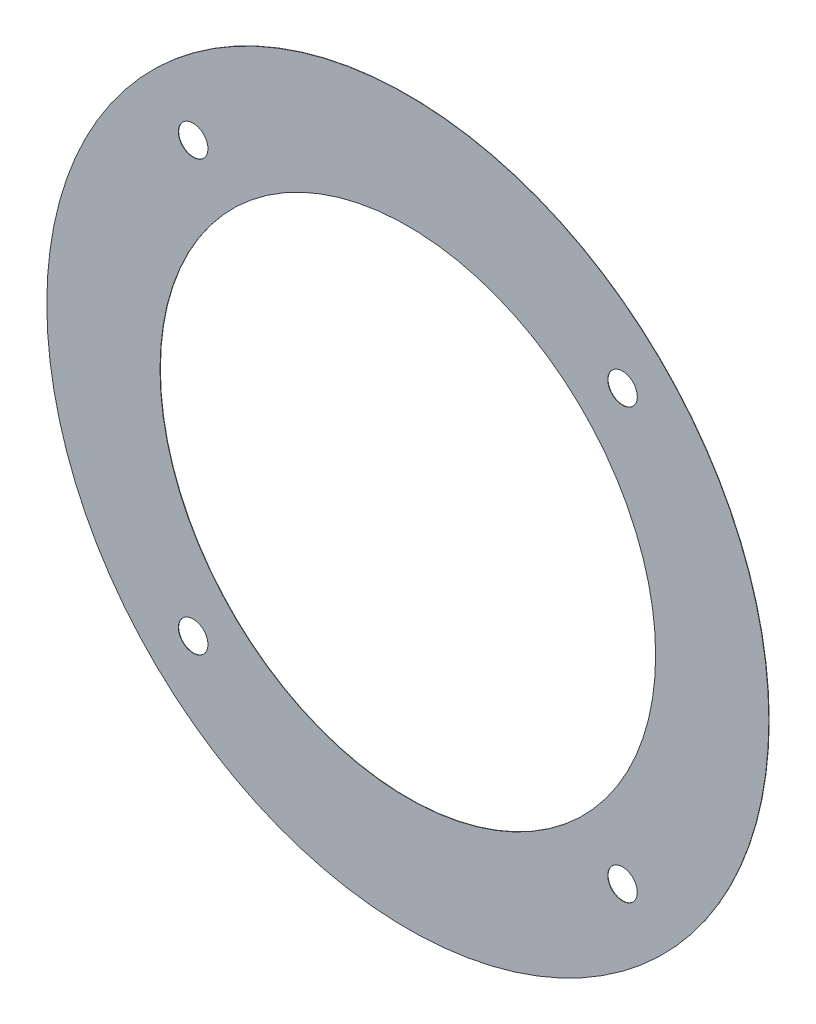
from build123d import *

# Parameters (mm, degrees)
SCHIZZO1_R                   = 110
SCHIZZO1_R_2                 = 75.5
ESTRUSIONE_ESTRUSIONE1_DEPTH = 0.1
SCHIZZO3_R                   = 4.5
TAGLIO_ESTRUSIONE1_DEPTH     = 156.563524002


with BuildPart() as part:
    # Schizzo1 → Estrusione-Estrusione1 (new body)
    with BuildSketch(Plane.XY):
        Circle(SCHIZZO1_R)
        Circle(SCHIZZO1_R_2, mode=Mode.SUBTRACT)
    extrude(amount=ESTRUSIONE_ESTRUSIONE1_DEPTH)

    # Schizzo3 → Taglio-Estrusione1 (cut, through all)
    with BuildSketch(Plane.XY.offset(0.1)):
        with Locations((-65.40737726, 65.40737726)):
            Circle(SCHIZZO3_R)
        with Locations((65.40737726, 65.40737726)):
            Circle(SCHIZZO3_R)
        with Locations((65.40737726, -65.40737726)):
            Circle(SCHIZZO3_R)
        with Locations((-65.40737726, -65.40737726)):
            Circle(SCHIZZO3_R)
    extrude(amount=-TAGLIO_ESTRUSIONE1_DEPTH, mode=Mode.SUBTRACT)


solid = part.part
